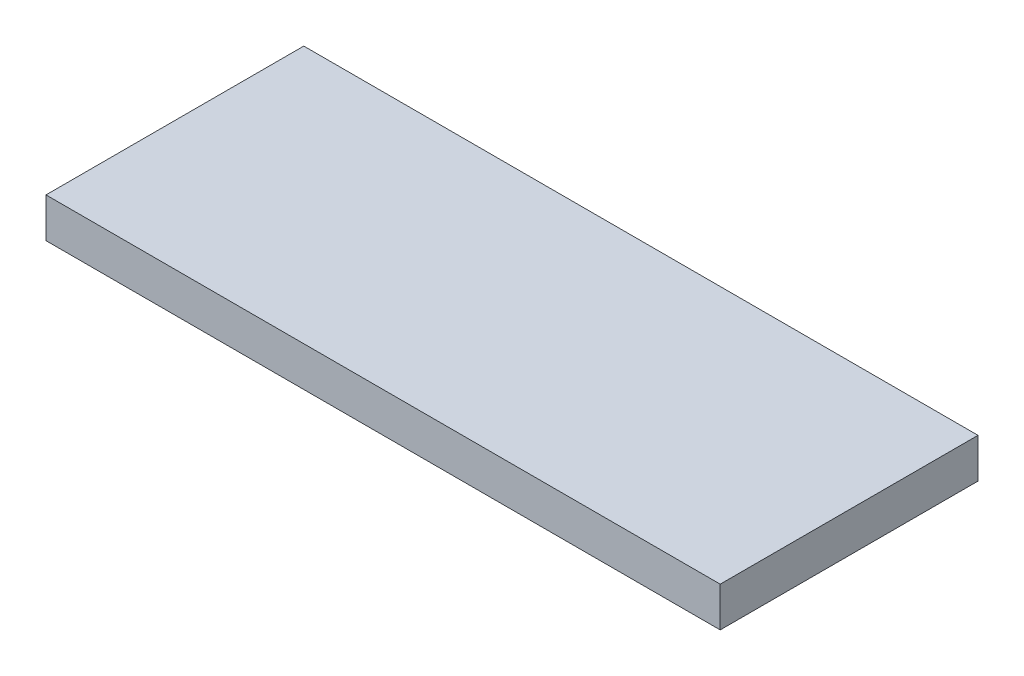
from build123d import *

# Parameters (mm, degrees)
SKETCH1_W           = 170
SKETCH1_H           = 65
BOSS_EXTRUDE1_DEPTH = 10
SKETCH2_W           = 10.857337547
SKETCH2_H           = 3.312408065
SKETCH2_W_2         = 12.51354158
SKETCH2_W_3         = 13.249632261
SKETCH2_H_2         = 5.336657438
SKETCH2_W_4         = 14.353768282
SKETCH2_W_5         = 26.867309862
SKETCH2_H_3         = 2.668328719
CUT_EXTRUDE1_DEPTH  = 5


with BuildPart() as part:
    # Sketch1 → Boss-Extrude1 (new body)
    with BuildSketch(Plane(origin=(0, 0, 0), x_dir=(1, 0, 0), z_dir=(0, 1, 0))):
        Rectangle(SKETCH1_W, SKETCH1_H)
    extrude(amount=BOSS_EXTRUDE1_DEPTH)

    # Sketch2 → Cut-Extrude1 (cut)
    with BuildSketch(Plane(origin=(0, 0, -32.5), x_dir=(-1, 0, 0), z_dir=(0, 0, -1))):
        with Locations((67.720342665, 4.232521417)):
            Rectangle(SKETCH2_W, SKETCH2_H)
        with Locations((51.250313674, 4.232521417)):
            Rectangle(SKETCH2_W_2, SKETCH2_H)
        with Locations((24.198981143, 5.244646103)):
            Rectangle(SKETCH2_W_3, SKETCH2_H_2)
        with Locations((1.932238038, 5.244646103)):
            Rectangle(SKETCH2_W_4, SKETCH2_H_2)
        with Locations((-21.990709099, 5.244646103)):
            Rectangle(SKETCH2_W_4, SKETCH2_H_2)
        with Locations((-57.139039123, 3.910481744)):
            Rectangle(SKETCH2_W_5, SKETCH2_H_3)
    extrude(amount=-CUT_EXTRUDE1_DEPTH, mode=Mode.SUBTRACT)


solid = part.part
